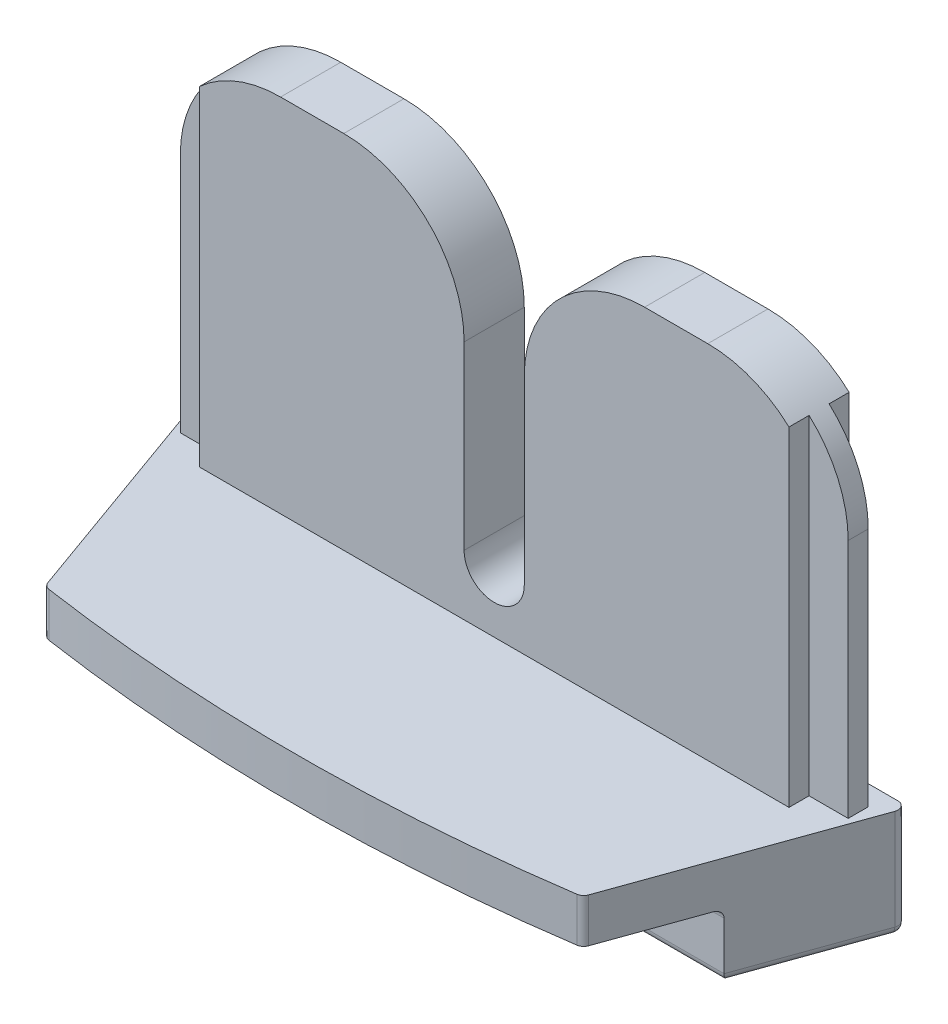
from build123d import *

# Parameters (mm, degrees)
BOSS_EXTRUDE1_DEPTH = 1.27
BOSS_EXTRUDE2_START = 1.27
BOSS_EXTRUDE2_DEPTH = 1.27
BOSS_EXTRUDE3_DEPTH = 1.27
BOSS_EXTRUDE4_DEPTH = 2.794
BOSS_EXTRUDE5_DEPTH = 4.064
FILLET1_R           = 0.508
FILLET3_R           = 7.62


with BuildPart() as part:
    # Sketch1 → Boss-Extrude1 (new body)
    with BuildSketch(Plane.XY):
        with BuildLine():
            Line((0, 0), (42.291, 0))
            Line((42.291, 0), (42.291, 22.86))
            Line((42.291, 22.86), (23.0505, 22.86))
            Line((23.0505, 22.86), (23.0505, 3.81))
            ThreePointArc((23.0505, 3.81), (21.1455, 1.905), (19.2405, 3.81))
            Line((19.2405, 3.81), (19.2405, 22.86))
            Line((19.2405, 22.86), (0, 22.86))
            Line((0, 22.86), (0, 0))
        make_face()
    extrude(amount=BOSS_EXTRUDE1_DEPTH)

    # Sketch2 → Boss-Extrude2 (add)
    with BuildSketch(Plane(origin=(0, 0, 0), x_dir=(-1, 0, 0), z_dir=(0, 0, -1)).offset(BOSS_EXTRUDE2_START)):
        with BuildLine():
            Line((-23.0505, 22.86), (-39.8145, 22.86))
            Line((-39.8145, 22.86), (-39.8145, 0))
            Line((-39.8145, 0), (-23.0505, 0))
            Line((-23.0505, 0), (-19.2405, 0))
            Line((-19.2405, 0), (-2.4765, 0))
            Line((-2.4765, 0), (-2.4765, 22.86))
            Line((-2.4765, 22.86), (-19.2405, 22.86))
            Line((-19.2405, 22.86), (-19.2405, 3.81))
            ThreePointArc((-19.2405, 3.81), (-21.1455, 1.905), (-23.0505, 3.81))
            Line((-23.0505, 3.81), (-23.0505, 22.86))
        make_face()
    extrude(amount=-BOSS_EXTRUDE2_DEPTH)

    # Sketch3 → Boss-Extrude3 (add)
    with BuildSketch(Plane.XY.offset(1.27)):
        with BuildLine():
            Line((19.2405, 22.86), (2.4765, 22.86))
            Line((2.4765, 22.86), (2.4765, 0))
            Line((2.4765, 0), (19.2405, 0))
            Line((19.2405, 0), (23.0505, 0))
            Line((23.0505, 0), (39.8145, 0))
            Line((39.8145, 0), (39.8145, 22.86))
            Line((39.8145, 22.86), (23.0505, 22.86))
            Line((23.0505, 22.86), (23.0505, 3.81))
            ThreePointArc((23.0505, 3.81), (21.1455, 1.905), (19.2405, 3.81))
            Line((19.2405, 3.81), (19.2405, 22.86))
        make_face()
    extrude(amount=BOSS_EXTRUDE3_DEPTH)

    # Sketch5 → Boss-Extrude4 (add)
    with BuildSketch(Plane.XZ):
        with BuildLine():
            Line((-1.3335, -1.27), (43.6245, -1.27))
            Line((43.6245, -1.27), (38.1635, 13.97))
            ThreePointArc((38.1635, 13.97), (21.1455, 15.24), (4.1275, 13.97))
            Line((4.1275, 13.97), (-1.3335, -1.27))
        make_face()
    extrude(amount=BOSS_EXTRUDE4_DEPTH)

    # Sketch6 → Boss-Extrude5 (add)
    with BuildSketch(Plane.XZ.offset(2.794)):
        Polygon((1.761066667, 7.366), (13.9065, 7.366), (13.9065, -1.27), (-1.3335, -1.27), align=None)
        Polygon((28.3845, -1.27), (43.6245, -1.27), (40.529933333, 7.366), (28.3845, 7.366), align=None)
    extrude(amount=BOSS_EXTRUDE5_DEPTH)

    # Fillet1
    fillet1_edges = [part.edges().sort_by_distance(p)[0] for p in [
        (28.3845, -2.794, 3.048),
        (34.457216667, -2.794, 7.366),
        (13.9065, -2.794, 3.048),
        (7.833783333, -2.794, 7.366),
        (13.9065, -4.826, -1.27),
        (21.1455, -2.794, -1.27),
        (36.0045, -6.858, -1.27),
        (28.3845, -6.858, 3.048),
        (34.457216667, -6.858, 7.366),
        (42.077216667, -6.858, 3.048),
        (7.833783333, -6.858, 7.366),
        (13.9065, -6.858, 3.048),
        (6.2865, -6.858, -1.27),
        (0.213783333, -6.858, 3.048),
        (-1.3335, -3.429, -1.27),
        (28.3845, -4.826, -1.27),
        (43.6245, -3.429, -1.27),
        (38.1635, -1.397, 13.97),
        (4.1275, -1.397, 13.97),
    ]]
    fillet(fillet1_edges, radius=FILLET1_R)

    # Fillet3
    fillet3_edges = [part.edges().sort_by_distance(p)[0] for p in [
        (23.0505, 22.86, 0.635),
        (19.2405, 22.86, 0.635),
        (0, 22.86, 0.635),
        (42.291, 22.86, 0.635),
    ]]
    fillet(fillet3_edges, radius=FILLET3_R)


solid = part.part
